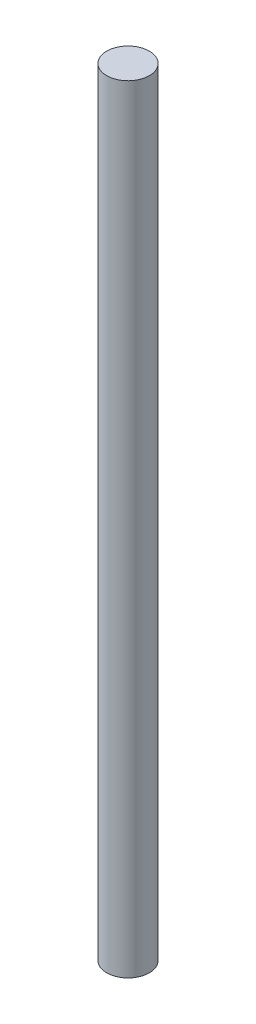
from build123d import *

# Parameters (mm, degrees)
SKETCH_1_R               = 2.5
EXTRUDE_1_DEPTH          = 173.2
SKETCH_3_R               = 77
EXTRUDE_4_DEPTH          = 4
SKETCH_8_R               = 15
EXTRUDE_7_DEPTH          = 3
CUT_EXTRUDE_2_REACH      = 198.527
SKETCH_9_R               = 5
PATTERN_CIRCULAR_1_COUNT = 3
SKETCH_11_R              = 2.5
CUT_EXTRUDE_4_DEPTH      = 143.040275978
EXTRUDE_START            = 6.6
SKETCH_12_R              = 2.5
EXTRUDE_8_DEPTH          = 6.6
CUT_EXTRUDE_6_REACH      = 138.076
SKETCH_13_R              = 77
SKETCH_13_R_2            = 15
SKETCH_14_R              = 15
CUT_EXTRUDE_7_DEPTH      = 10
SKETCH_15_R              = 2.5
EXTRUDE_9_DEPTH          = 10


with BuildPart() as part:
    # 草图1 → 凸台-拉伸1 (new body)
    with BuildSketch(Plane(origin=(0, 0, 0), x_dir=(1, 0, 0), z_dir=(0, 1, 0))):
        with Locations(Location((0, 0, 0), (0, 0, 90))):
            Circle(SKETCH_1_R)
    extrude(amount=EXTRUDE_1_DEPTH)

    # 草图3 → 凸台-拉伸4 (add)
    with BuildSketch(Plane(origin=(0, 163.6, 0), x_dir=(1, 0, 0), z_dir=(0, 1, 0))):
        with Locations(Location((0, 0, 0), (0, 0, 270))):
            Circle(SKETCH_3_R)
    extrude(amount=-EXTRUDE_4_DEPTH)

    # 草图8 → 凸台-拉伸7 (add)
    with BuildSketch(Plane(origin=(0, 159.6, 0), x_dir=(-1, 0, 0), z_dir=(0, -1, 0))):
        with Locations(Location((0, 0, 0), (0, 0, 270))):
            Circle(SKETCH_8_R)
    extrude(amount=EXTRUDE_7_DEPTH)

    # 草图9 → 切除-拉伸2 (cut, up to next)
    with BuildSketch(Plane(origin=(0, 163.6, 0), x_dir=(1, 0, 0), z_dir=(0, 1, 0)), mode=Mode.PRIVATE) as cut_extrude_2_sk1:
        with Locations(Location((0, 45, 0), (0, 0, 270))):
            Circle(SKETCH_9_R)
    cut_extrude_2_tool1 = extrude(cut_extrude_2_sk1.sketch, amount=-CUT_EXTRUDE_2_REACH, mode=Mode.PRIVATE) & part.part
    cut_extrude_2 = cut_extrude_2_tool1.solids().sort_by_distance((0, 163.6, -45))[0]
    add(cut_extrude_2, mode=Mode.SUBTRACT)

    # 阵列(圆周)1: 切除-拉伸2 ×3 about axis
    pattern_circular_1_axis = Axis((0, 0, 0), (0, 1, 0))
    for i in range(1, PATTERN_CIRCULAR_1_COUNT):
        add(cut_extrude_2.rotate(pattern_circular_1_axis, i * 360 / PATTERN_CIRCULAR_1_COUNT), mode=Mode.SUBTRACT)

    # 草图11 → 切除-拉伸4 (cut, through all)
    with BuildSketch(Plane(origin=(0, 82, 0), x_dir=(1, 0, 0), z_dir=(0, 1, 0))):
        with Locations(Location((0, 0, 0), (0, 0, 90))):
            Circle(SKETCH_11_R)
    extrude(amount=-CUT_EXTRUDE_4_DEPTH, mode=Mode.SUBTRACT)

    # 草图12 → 凸台-拉伸8 (add)
    with BuildSketch(Plane(origin=(0, 153.6, 0), x_dir=(-1, 0, 0), z_dir=(0, -1, 0)).offset(EXTRUDE_START)):
        with Locations(Location((0, 0, 0), (0, 0, 90))):
            Circle(SKETCH_12_R)
    extrude(amount=-EXTRUDE_8_DEPTH)

    # 草图13 → 切除-拉伸6 (cut, up to next)
    with BuildSketch(Plane(origin=(0, 163.6, 0), x_dir=(1, 0, 0), z_dir=(0, 1, 0)), mode=Mode.PRIVATE) as cut_extrude_6_sk1:
        Circle(SKETCH_13_R)
        with Locations(Location((0, 0, 0), (0, 0, 270))):
            Circle(SKETCH_13_R_2, mode=Mode.SUBTRACT)
    cut_extrude_6_tool1 = extrude(cut_extrude_6_sk1.sketch, amount=-CUT_EXTRUDE_6_REACH, mode=Mode.PRIVATE) & part.part
    add(cut_extrude_6_tool1.solids().sort_by_distance((-74.822111, 163.6, 0))[0], mode=Mode.SUBTRACT)

    # 草图14 → 切除-拉伸7 (cut)
    with BuildSketch(Plane(origin=(0, 163.6, 0), x_dir=(1, 0, 0), z_dir=(0, 1, 0))):
        Circle(SKETCH_14_R)
    extrude(amount=-CUT_EXTRUDE_7_DEPTH, mode=Mode.SUBTRACT)


with BuildPart() as cut_extrude_7_piece_1:
    # of the separate pieces the step leaves, piece 1, a body of its own (cut_extrude_7_pieces)
    add(part.part.solids().sort_by_distance((0, 82, -2.5))[0])



with BuildPart() as cut_extrude_7_piece_2:
    # of the separate pieces the step leaves, piece 2, a body of its own (cut_extrude_7_pieces)
    add(part.part.solids().sort_by_distance((0, 163.6, -2.5))[0])


with BuildPart() as cut_extrude_7_piece_1_1:
    add(cut_extrude_7_piece_1.part)

    add(cut_extrude_7_piece_2.part)  # 凸台-拉伸9 merges 切除-拉伸7 piece 2
    # 草图15 → 凸台-拉伸9 (add)
    with BuildSketch(Plane(origin=(0, 153.6, 0), x_dir=(-1, 0, 0), z_dir=(0, -1, 0))):
        with Locations(Location((0, 0, 0), (0, 0, 90))):
            Circle(SKETCH_15_R)
    extrude(amount=-EXTRUDE_9_DEPTH)


solid = cut_extrude_7_piece_1_1.part
